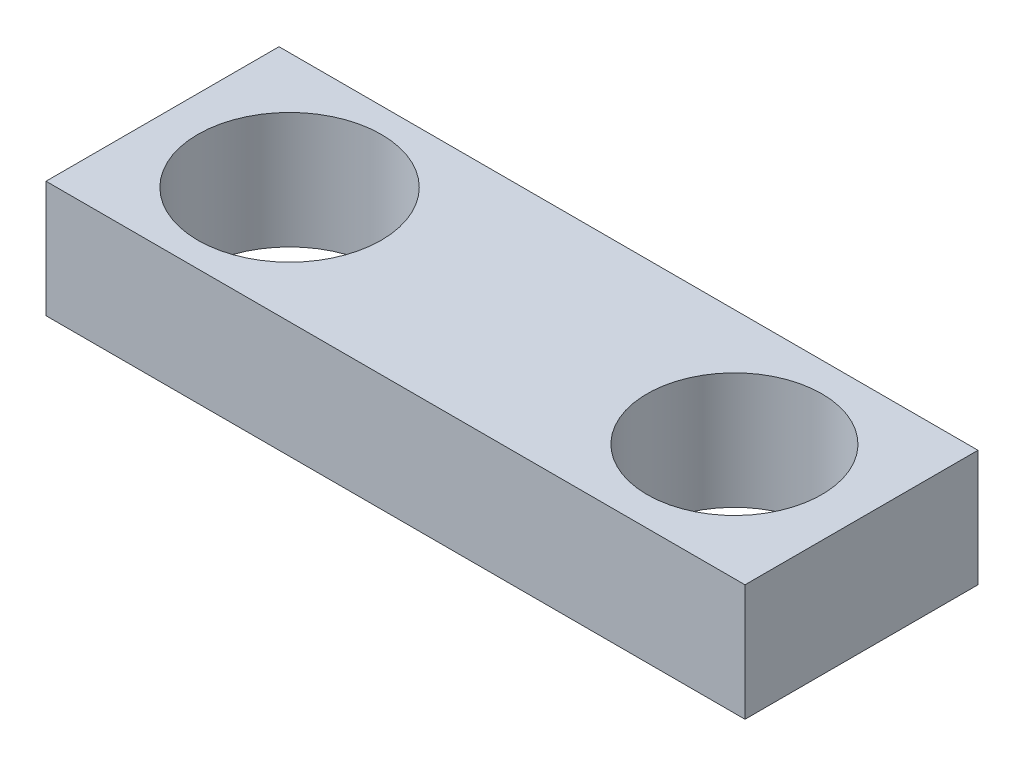
from build123d import *

# Parameters (mm, degrees)
SKETCH1_W           = 38.1
SKETCH1_H           = 12.7
SKETCH1_R           = 5
SKETCH1_R_2         = 4.7625
BOSS_EXTRUDE1_DEPTH = 6.35


with BuildPart() as part:
    # Sketch1 → Boss-Extrude1 (new body)
    with BuildSketch(Plane(origin=(0, 0, 0), x_dir=(1, 0, 0), z_dir=(0, 1, 0))):
        Rectangle(SKETCH1_W, SKETCH1_H)
        with Locations(Location((-12.12469, 0, 0), (0, 0, 270))):
            Circle(SKETCH1_R, mode=Mode.SUBTRACT)
        with Locations(Location((12.12469, 0, 0), (0, 0, 270))):
            Circle(SKETCH1_R_2, mode=Mode.SUBTRACT)
    extrude(amount=BOSS_EXTRUDE1_DEPTH)


solid = part.part
